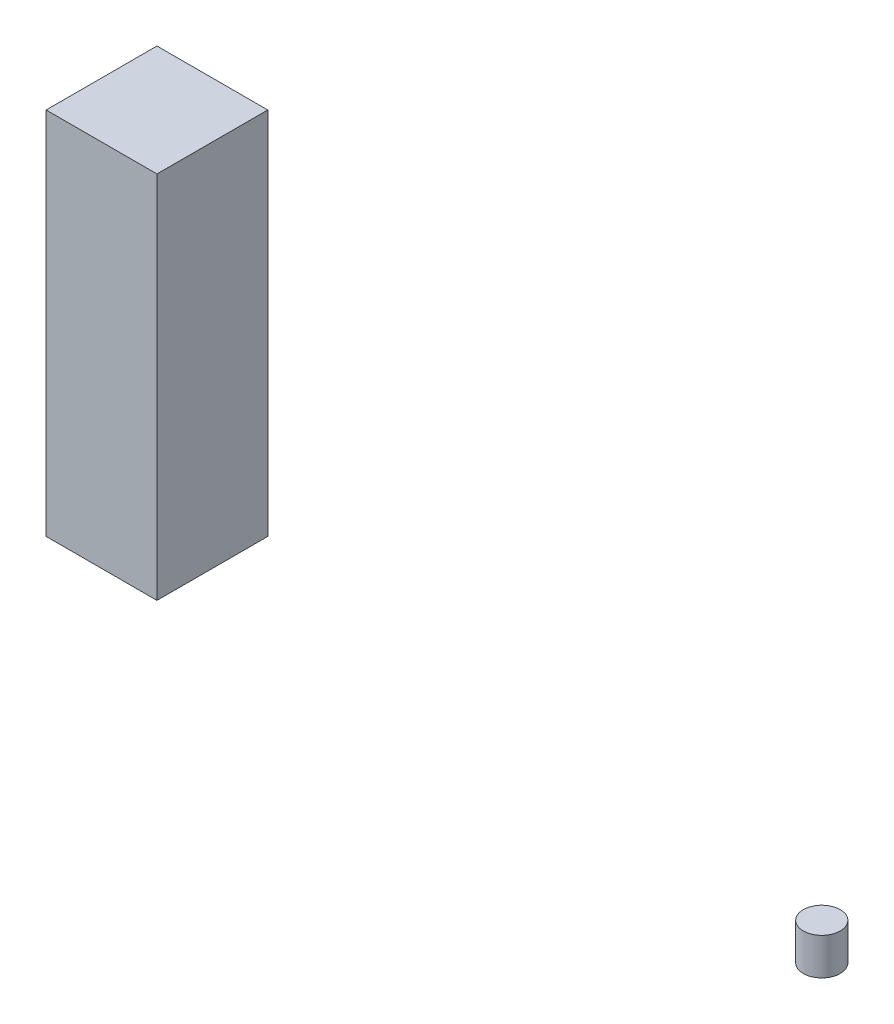
from build123d import *

# Parameters (mm, degrees)
SKETCH1_W           = 30
SKETCH1_H           = 30
BOSS_EXTRUDE1_DEPTH = 100
SKETCH2_R           = 5
BOSS_EXTRUDE2_DEPTH = 10


with BuildPart() as part:
    # Sketch1 → Boss-Extrude1 (new body)
    with BuildSketch(Plane(origin=(0, 0, 0), x_dir=(1, 0, 0), z_dir=(0, 1, 0))):
        Rectangle(SKETCH1_W, SKETCH1_H)
    extrude(amount=BOSS_EXTRUDE1_DEPTH)


with BuildPart() as body_2:
    # Sketch2 → Boss-Extrude2 (new body)
    with BuildSketch(Plane.XZ):
        with Locations(Location((180, 0, 0), (0, 0, 270))):
            Circle(SKETCH2_R)
    extrude(amount=BOSS_EXTRUDE2_DEPTH)


solid = Compound([part.part, body_2.part])
